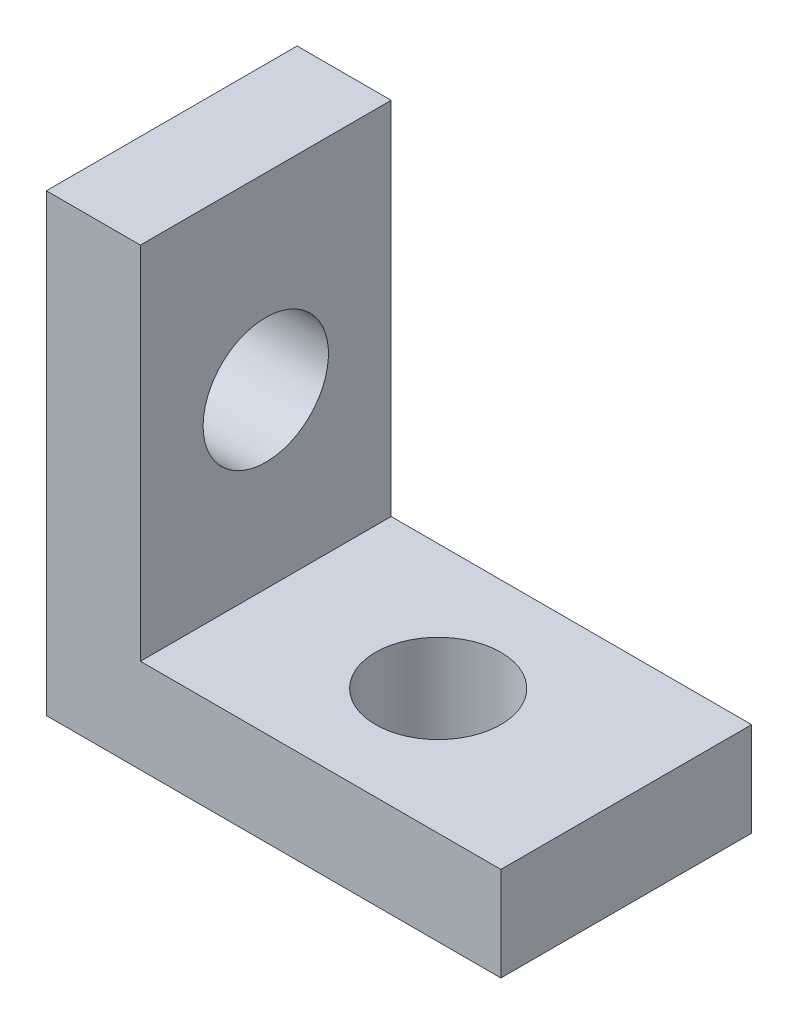
from build123d import *

# Parameters (mm, degrees)
EXTRUDE_1_DEPTH     = 8
SKETCH_2_R          = 2
CUT_EXTRUDE_1_DEPTH = 23.011360703
SKETCH_3_R          = 2
CUT_EXTRUDE_3_DEPTH = 8


with BuildPart() as part:
    # 草图1 → 凸台-拉伸1 (new body)
    with BuildSketch(Plane.XY):
        Polygon((0, 0), (14.5, 0), (14.5, 3), (3, 3), (3, 14.5), (0, 14.5), align=None)
    extrude(amount=EXTRUDE_1_DEPTH)

    # 草图2 → 切除-拉伸1 (cut, through all)
    with BuildSketch(Plane.XZ):
        with Locations(Location((8.5, 4, 0), (0, 0, 270))):
            Circle(SKETCH_2_R)
    extrude(amount=-CUT_EXTRUDE_1_DEPTH, mode=Mode.SUBTRACT)

    # 草图3 → 切除-拉伸3 (cut)
    with BuildSketch(Plane.ZY):
        with Locations((4, 8.5)):
            Circle(SKETCH_3_R)
    extrude(amount=-CUT_EXTRUDE_3_DEPTH, mode=Mode.SUBTRACT)


solid = part.part
